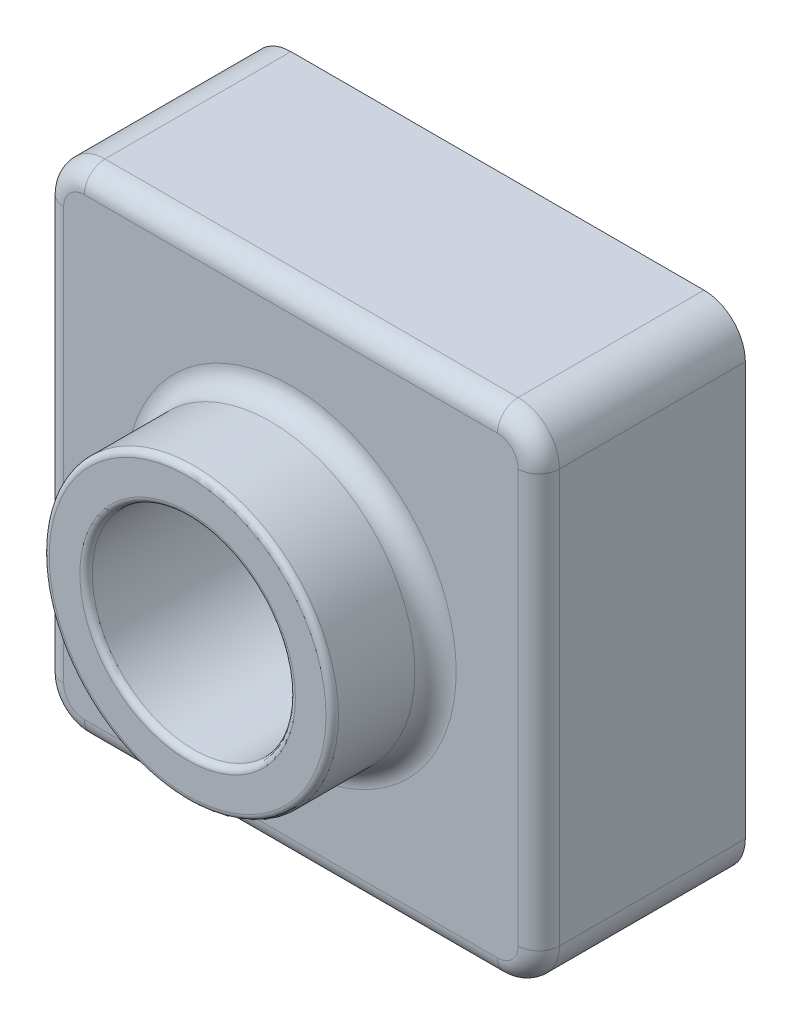
from build123d import *

# Parameters (mm, degrees)
SKETCH1_W           = 120
SKETCH1_H           = 120
BOSS_EXTRUDE1_DEPTH = 50
SKETCH3_R           = 35
BOSS_EXTRUDE2_DEPTH = 25
SKETCH8_R           = 24.585181497
CUT_EXTRUDE1_DEPTH  = 186.539753153
FILLET1_R           = 10
FILLET2_R           = 1.5
FILLET3_R           = 5
SHELL1_T            = -2


with BuildPart() as part:
    # Sketch1 → Boss-Extrude1 (new body)
    with BuildSketch(Plane.XY):
        with Locations((-60, 60)):
            Rectangle(SKETCH1_W, SKETCH1_H)
    extrude(amount=BOSS_EXTRUDE1_DEPTH)

    # Sketch3 → Boss-Extrude2 (add)
    with BuildSketch(Plane.XY.offset(50)):
        with Locations((-60, 60)):
            Circle(SKETCH3_R)
    extrude(amount=BOSS_EXTRUDE2_DEPTH)

    # Sketch8 → Cut-Extrude1 (cut, through all)
    with BuildSketch(Plane.XY.offset(75)):
        with Locations((-60, 60)):
            Circle(SKETCH8_R)
    extrude(amount=-CUT_EXTRUDE1_DEPTH, mode=Mode.SUBTRACT)

    # Fillet1
    fillet1_edges = [part.edges().sort_by_distance(p)[0] for p in [
        (0, 0, 25),
        (-120, 0, 25),
        (-120, 120, 25),
        (0, 120, 25),
    ]]
    fillet(fillet1_edges, radius=FILLET1_R)

    # Fillet2
    fillet2_edges = [part.edges().sort_by_distance(p)[0] for p in [
        (-95, 60, 75),
        (-84.585181497, 60, 75),
    ]]
    fillet(fillet2_edges, radius=FILLET2_R)

    # Fillet3
    fillet3_edges = [part.edges().sort_by_distance(p)[0] for p in [
        (-95, 60, 50),
        (-60, 0, 50),
        (-120, 60, 50),
        (0, 60, 50),
        (-60, 120, 50),
        (-2.928932188, 117.071067812, 50),
        (-117.071067812, 117.071067812, 50),
        (-2.928932188, 2.928932188, 50),
        (-117.071067812, 2.928932188, 50),
    ]]
    fillet(fillet3_edges, radius=FILLET3_R)

    # Shell1
    shell1_openings = [part.faces().sort_by_distance(p)[0] for p in [
        (-60, 1.697056275, 0),
    ]]
    offset(amount=SHELL1_T, openings=shell1_openings, kind=Kind.INTERSECTION)


solid = part.part
